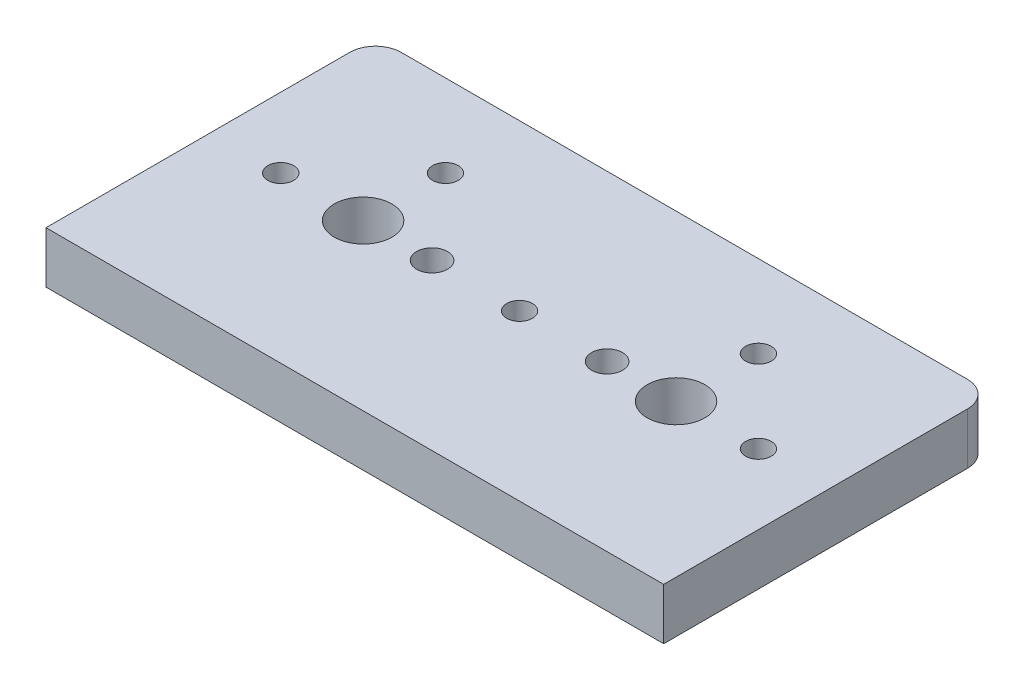
from build123d import *

# Parameters (mm, degrees)
SKETCH_1_W          = 60
SKETCH_1_H          = 32
EXTRUDE_1_DEPTH     = 5
SKETCH_2_R          = 1.5
SKETCH_2_R_2        = 1.25
SKETCH_2_R_3        = 2.8
CUT_EXTRUDE_1_DEPTH = 5
FILLET_1_R          = 2.5


with BuildPart() as part:
    # 草图1 → 凸台-拉伸1 (new body)
    with BuildSketch(Plane(origin=(0, 0, 0), x_dir=(1, 0, 0), z_dir=(0, 1, 0))):
        Rectangle(SKETCH_1_W, SKETCH_1_H)
    extrude(amount=EXTRUDE_1_DEPTH)

    # 草图2 → 切除-拉伸1 (cut)
    with BuildSketch(Plane(origin=(0, 5, 0), x_dir=(1, 0, 0), z_dir=(0, 1, 0))):
        with Locations(Location((8.5, 0, 0), (0, 0, 270))):
            Circle(SKETCH_2_R)
        with Locations(Location((-8.5, 0, 0), (0, 0, 90))):
            Circle(SKETCH_2_R)
        with Locations(Location((0, 0, 0), (0, 0, 270))):
            Circle(SKETCH_2_R_2)
        with Locations(Location((15.2, 0, 0), (0, 0, 270))):
            Circle(SKETCH_2_R_3)
        with Locations(Location((-15.2, 0, 0), (0, 0, 90))):
            Circle(SKETCH_2_R_3)
        with Locations(Location((15.2, 8, 0), (0, 0, 270))):
            Circle(SKETCH_2_R_2)
        with Locations(Location((23.2, 0, 0), (0, 0, 270))):
            Circle(SKETCH_2_R_2)
        with Locations(Location((-23.2, 0, 0), (0, 0, 90))):
            Circle(SKETCH_2_R_2)
        with Locations(Location((-15.2, 8, 0), (0, 0, 90))):
            Circle(SKETCH_2_R_2)
    extrude(amount=-CUT_EXTRUDE_1_DEPTH, mode=Mode.SUBTRACT)

    # 圆角1
    fillet_1_edges = [part.edges().sort_by_distance(p)[0] for p in [
        (-30, 2.5, -16),
        (30, 2.5, -16),
    ]]
    fillet(fillet_1_edges, radius=FILLET_1_R)


solid = part.part
